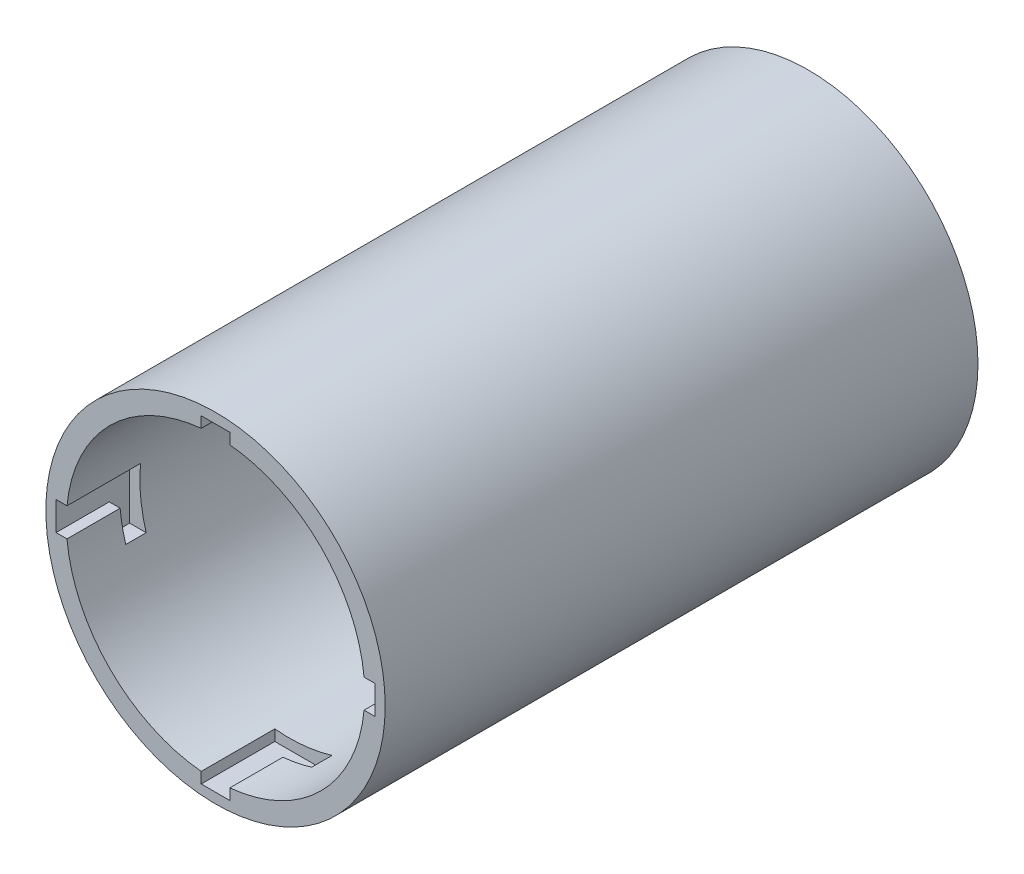
from build123d import *

# Parameters (mm, degrees)
SKETCH2_R           = 41.5
SKETCH2_R_2         = 36.5
BOSS_EXTRUDE2_DEPTH = 140
BOSS_EXTRUDE3_START = -5
SKETCH13_R          = 41.5
SKETCH13_R_2        = 4.5
BOSS_EXTRUDE3_DEPTH = 5
CUT_EXTRUDE1_DEPTH  = 39
CUT_EXTRUDE2_DEPTH  = 39
CUT_EXTRUDE3_DEPTH  = 39
CUT_EXTRUDE4_DEPTH  = 39


with BuildPart() as part:
    # Sketch2 → Boss-Extrude2 (new body)
    with BuildSketch(Plane.XY):
        Circle(SKETCH2_R)
        Circle(SKETCH2_R_2, mode=Mode.SUBTRACT)
    extrude(amount=BOSS_EXTRUDE2_DEPTH)

    # Sketch13 → Boss-Extrude3 (add)
    with BuildSketch(Plane.XY.offset(BOSS_EXTRUDE3_START)):
        Circle(SKETCH13_R)
        Circle(SKETCH13_R_2, mode=Mode.SUBTRACT)
    extrude(amount=BOSS_EXTRUDE3_DEPTH)

    # Sketch14 → Cut-Extrude1 (cut)
    with BuildSketch(Plane(origin=(0, 0, 0), x_dir=(1, 0, 0), z_dir=(0, 1, 0))):
        Polygon((3.5, -127), (10.5, -127), (10.5, -122), (-3.5, -122), (-3.5, -140), (3.5, -140), align=None)
    extrude(amount=-CUT_EXTRUDE1_DEPTH, mode=Mode.SUBTRACT)

    # Sketch16 → Cut-Extrude2 (cut)
    with BuildSketch(Plane(origin=(0, 0, 0), x_dir=(0, 0, -1), z_dir=(1, 0, 0))):
        Polygon((-140, 3.548648678), (-127, 3.548648678), (-127, 10.548648678), (-122, 10.548648678), (-122, -3.451351322), (-140, -3.451351322), align=None)
    extrude(amount=CUT_EXTRUDE2_DEPTH, mode=Mode.SUBTRACT)

    # Sketch19 → Cut-Extrude3 (cut)
    with BuildSketch(Plane(origin=(0, 0, 0), x_dir=(1, 0, 0), z_dir=(0, 1, 0))):
        Polygon((3.5, -140), (3.5, -122), (-10.5, -122), (-10.5, -127), (-3.5, -127), (-3.5, -140), align=None)
    extrude(amount=CUT_EXTRUDE3_DEPTH, mode=Mode.SUBTRACT)

    # Sketch20 → Cut-Extrude4 (cut)
    with BuildSketch(Plane(origin=(0, 0, 0), x_dir=(0, 0, -1), z_dir=(1, 0, 0))):
        Polygon((-127, -3.5), (-140, -3.5), (-140, 3.5), (-122, 3.5), (-122, -10.5), (-127, -10.5), align=None)
    extrude(amount=-CUT_EXTRUDE4_DEPTH, mode=Mode.SUBTRACT)


solid = part.part
